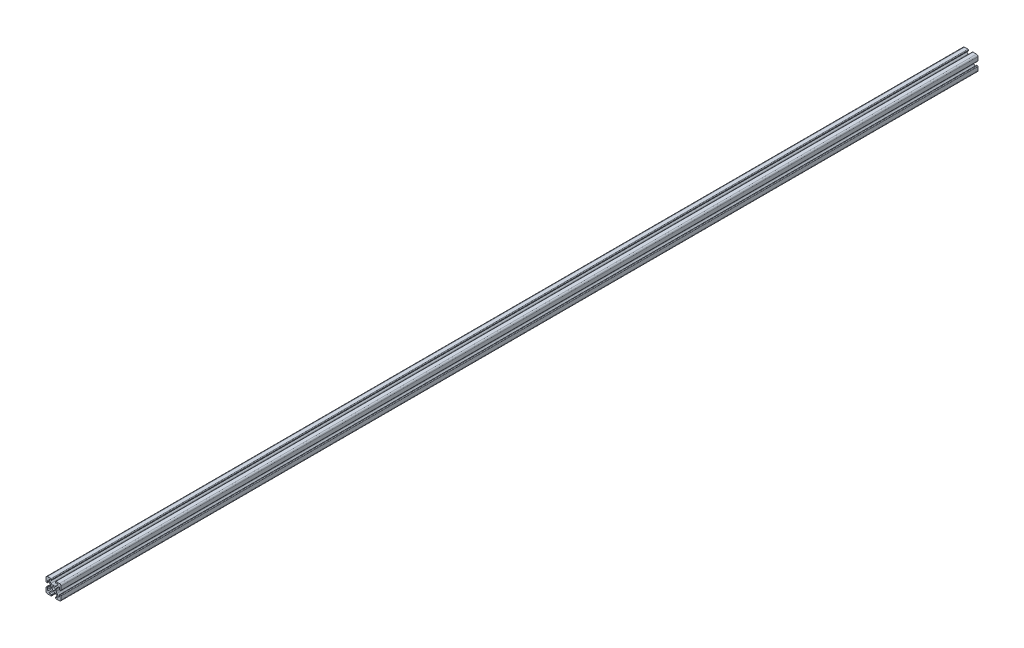
from build123d import *

# Parameters (mm, degrees)
SKETCH1_R           = 2.1463
BOSS_EXTRUDE1_DEPTH = 609.6


with BuildPart() as part:
    # Sketch1 → Boss-Extrude1 (new, symmetric)
    with BuildSketch(Plane.XY):
        with BuildLine():
            Line((-9.9949, 7.9883), (-9.9949, 3.2893))
            ThreePointArc((-9.9949, 3.2893), (-9.76427588, 2.73252412), (-9.2075, 2.5019))
            Line((-9.2075, 2.5019), (-8.4963, 2.5019))
            ThreePointArc((-8.4963, 2.5019), (-8.280773853, 2.591173853), (-8.1915, 2.8067))
            Line((-8.1915, 2.8067), (-8.1915, 4.9149))
            ThreePointArc((-8.1915, 4.9149), (-7.674065253, 5.689295824), (-6.760603096, 5.507596904))
            Line((-6.760603096, 5.507596904), (-4.505765747, 3.252759555))
            ThreePointArc((-4.505765747, 3.252759555), (-3.856054457, 2.280397894), (-3.627906192, 1.133419111))
            Line((-3.627906192, 1.133419111), (-3.627906192, -1.133419111))
            ThreePointArc((-3.627906192, -1.133419111), (-3.856054457, -2.280397894), (-4.505765747, -3.252759555))
            Line((-4.505765747, -3.252759555), (-6.760603096, -5.507596904))
            ThreePointArc((-6.760603096, -5.507596904), (-7.674065253, -5.689295824), (-8.1915, -4.9149))
            Line((-8.1915, -4.9149), (-8.1915, -2.8067))
            ThreePointArc((-8.1915, -2.8067), (-8.280773853, -2.591173853), (-8.4963, -2.5019))
            Line((-8.4963, -2.5019), (-9.2075, -2.5019))
            ThreePointArc((-9.2075, -2.5019), (-9.76427588, -2.73252412), (-9.9949, -3.2893))
            Line((-9.9949, -3.2893), (-9.9949, -7.9883))
            ThreePointArc((-9.9949, -7.9883), (-9.407180467, -9.407180467), (-7.9883, -9.9949))
            Line((-7.9883, -9.9949), (-3.2893, -9.9949))
            ThreePointArc((-3.2893, -9.9949), (-2.73252412, -9.76427588), (-2.5019, -9.2075))
            Line((-2.5019, -9.2075), (-2.5019, -8.4963))
            ThreePointArc((-2.5019, -8.4963), (-2.591173853, -8.280773853), (-2.8067, -8.1915))
            Line((-2.8067, -8.1915), (-4.9149, -8.1915))
            ThreePointArc((-4.9149, -8.1915), (-5.689295824, -7.674065253), (-5.507596904, -6.760603096))
            Line((-5.507596904, -6.760603096), (-3.252759555, -4.505765747))
            ThreePointArc((-3.252759555, -4.505765747), (-2.280397894, -3.856054457), (-1.133419111, -3.627906192))
            Line((-1.133419111, -3.627906192), (1.133419111, -3.627906192))
            ThreePointArc((1.133419111, -3.627906192), (2.280397894, -3.856054457), (3.252759555, -4.505765747))
            Line((3.252759555, -4.505765747), (5.507596904, -6.760603096))
            ThreePointArc((5.507596904, -6.760603096), (5.689295824, -7.674065253), (4.9149, -8.1915))
            Line((4.9149, -8.1915), (2.8067, -8.1915))
            ThreePointArc((2.8067, -8.1915), (2.591173853, -8.280773853), (2.5019, -8.4963))
            Line((2.5019, -8.4963), (2.5019, -9.2075))
            ThreePointArc((2.5019, -9.2075), (2.73252412, -9.76427588), (3.2893, -9.9949))
            Line((3.2893, -9.9949), (7.9883, -9.9949))
            ThreePointArc((7.9883, -9.9949), (9.407180467, -9.407180467), (9.9949, -7.9883))
            Line((9.9949, -7.9883), (9.9949, -3.2893))
            ThreePointArc((9.9949, -3.2893), (9.76427588, -2.73252412), (9.2075, -2.5019))
            Line((9.2075, -2.5019), (8.4963, -2.5019))
            ThreePointArc((8.4963, -2.5019), (8.280773853, -2.591173853), (8.1915, -2.8067))
            Line((8.1915, -2.8067), (8.1915, -4.9149))
            ThreePointArc((8.1915, -4.9149), (7.674065253, -5.689295824), (6.760603096, -5.507596904))
            Line((6.760603096, -5.507596904), (4.505765747, -3.252759555))
            ThreePointArc((4.505765747, -3.252759555), (3.856054457, -2.280397894), (3.627906192, -1.133419111))
            Line((3.627906192, -1.133419111), (3.627906192, 1.133419111))
            ThreePointArc((3.627906192, 1.133419111), (3.856054457, 2.280397894), (4.505765747, 3.252759555))
            Line((4.505765747, 3.252759555), (6.760603096, 5.507596904))
            ThreePointArc((6.760603096, 5.507596904), (7.674065253, 5.689295824), (8.1915, 4.9149))
            Line((8.1915, 4.9149), (8.1915, 2.8067))
            ThreePointArc((8.1915, 2.8067), (8.280773853, 2.591173853), (8.4963, 2.5019))
            Line((8.4963, 2.5019), (9.2075, 2.5019))
            ThreePointArc((9.2075, 2.5019), (9.76427588, 2.73252412), (9.9949, 3.2893))
            Line((9.9949, 3.2893), (9.9949, 7.9883))
            ThreePointArc((9.9949, 7.9883), (9.407180467, 9.407180467), (7.9883, 9.9949))
            Line((7.9883, 9.9949), (3.2893, 9.9949))
            ThreePointArc((3.2893, 9.9949), (2.73252412, 9.76427588), (2.5019, 9.2075))
            Line((2.5019, 9.2075), (2.5019, 8.4963))
            ThreePointArc((2.5019, 8.4963), (2.591173853, 8.280773853), (2.8067, 8.1915))
            Line((2.8067, 8.1915), (4.9149, 8.1915))
            ThreePointArc((4.9149, 8.1915), (5.689295824, 7.674065253), (5.507596904, 6.760603096))
            Line((5.507596904, 6.760603096), (3.252759555, 4.505765747))
            ThreePointArc((3.252759555, 4.505765747), (2.280397894, 3.856054457), (1.133419111, 3.627906192))
            Line((1.133419111, 3.627906192), (-1.133419111, 3.627906192))
            ThreePointArc((-1.133419111, 3.627906192), (-2.280397894, 3.856054457), (-3.252759555, 4.505765747))
            Line((-3.252759555, 4.505765747), (-5.507596904, 6.760603096))
            ThreePointArc((-5.507596904, 6.760603096), (-5.689295824, 7.674065253), (-4.9149, 8.1915))
            Line((-4.9149, 8.1915), (-2.8067, 8.1915))
            ThreePointArc((-2.8067, 8.1915), (-2.591173853, 8.280773853), (-2.5019, 8.4963))
            Line((-2.5019, 8.4963), (-2.5019, 9.2075))
            ThreePointArc((-2.5019, 9.2075), (-2.73252412, 9.76427588), (-3.2893, 9.9949))
            Line((-3.2893, 9.9949), (-7.9883, 9.9949))
            ThreePointArc((-7.9883, 9.9949), (-9.407180467, 9.407180467), (-9.9949, 7.9883))
        make_face()
        Circle(SKETCH1_R, mode=Mode.SUBTRACT)
    extrude(amount=BOSS_EXTRUDE1_DEPTH, both=True)


solid = part.part
